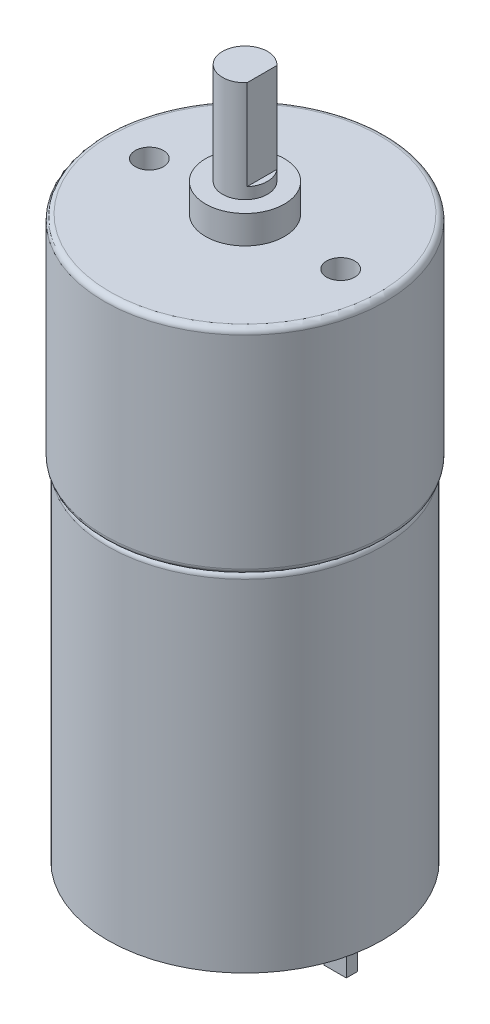
from build123d import *

# Parameters (mm, degrees)
SKETCH1_R                 = 12.2
BOSS_EXTRUDE1_DEPTH       = 30.8
FILLET1_R                 = 0.5
SKETCH2_R                 = 12.5
BOSS_EXTRUDE2_DEPTH       = 19
SKETCH3_R                 = 3.5
BOSS_EXTRUDE3_DEPTH       = 2.5
SKETCH4_R                 = 2
BOSS_EXTRUDE4_DEPTH       = 9
CUT_EXTRUDE1_START        = -8
CUT_EXTRUDE1_DEPTH        = 8
FILLET2_R                 = 0.5
M3X0_5_TAPPED_HOLE1_D     = 2.5
M3X0_5_TAPPED_HOLE1_DEPTH = 5
M3X0_5_TAPPED_HOLE1_TIP   = 0.751075774
SKETCH10_W                = 2
SKETCH10_H                = 1
BOSS_EXTRUDE5_DEPTH       = 4
SKETCH11_R                = 3.25
BOSS_EXTRUDE6_DEPTH       = 2


with BuildPart() as part:
    # Sketch1 → Boss-Extrude1 (new body)
    with BuildSketch(Plane(origin=(0, 0, 0), x_dir=(1, 0, 0), z_dir=(0, 1, 0))):
        Circle(SKETCH1_R)
    extrude(amount=BOSS_EXTRUDE1_DEPTH)

    # Fillet1
    fillet1_edges = [part.edges().sort_by_distance(p)[0] for p in [
        (-12.2, 30.8, 0),
    ]]
    fillet(fillet1_edges, radius=FILLET1_R)

    # Sketch2 → Boss-Extrude2 (add)
    with BuildSketch(Plane(origin=(0, 30.8, 0), x_dir=(1, 0, 0), z_dir=(0, 1, 0))):
        Circle(SKETCH2_R)
    extrude(amount=BOSS_EXTRUDE2_DEPTH)

    # Sketch3 → Boss-Extrude3 (add)
    with BuildSketch(Plane(origin=(0, 49.8, 0), x_dir=(1, 0, 0), z_dir=(0, 1, 0))):
        Circle(SKETCH3_R)
    extrude(amount=BOSS_EXTRUDE3_DEPTH)

    # Sketch4 → Boss-Extrude4 (add)
    with BuildSketch(Plane(origin=(0, 52.3, 0), x_dir=(1, 0, 0), z_dir=(0, 1, 0))):
        Circle(SKETCH4_R)
    extrude(amount=BOSS_EXTRUDE4_DEPTH)

    # Sketch5 → Cut-Extrude1 (cut)
    with BuildSketch(Plane(origin=(0, 61.3, 0), x_dir=(1, 0, 0), z_dir=(0, 1, 0)).offset(CUT_EXTRUDE1_START)):
        with BuildLine():
            Line((1.5, 1.322875656), (1.5, -1.322875656))
            ThreePointArc((1.5, -1.322875656), (2, 0), (1.5, 1.322875656))
        make_face()
    extrude(amount=CUT_EXTRUDE1_DEPTH, mode=Mode.SUBTRACT)

    # Fillet2
    fillet2_edges = [part.edges().sort_by_distance(p)[0] for p in [
        (-12.5, 49.8, 0),
        (-12.5, 30.8, 0),
    ]]
    fillet(fillet2_edges, radius=FILLET2_R)

    # M3x0.5 Tapped Hole1
    with Locations(Plane(origin=(0, 49.8, 0), x_dir=(1, 0, 0), z_dir=(0, 1, 0))):
        with Locations((-8.5, 0), (8.5, 0)):
            Hole(M3X0_5_TAPPED_HOLE1_D / 2, depth=M3X0_5_TAPPED_HOLE1_DEPTH)
            with Locations((0, 0, -(M3X0_5_TAPPED_HOLE1_DEPTH + M3X0_5_TAPPED_HOLE1_TIP / 2))):  # 118° drill point
                Cone(0, M3X0_5_TAPPED_HOLE1_D / 2, M3X0_5_TAPPED_HOLE1_TIP, mode=Mode.SUBTRACT)

    # Sketch10 → Boss-Extrude5 (add)
    with BuildSketch(Plane.XZ):
        with Locations((-8.5, 0)):
            Rectangle(SKETCH10_W, SKETCH10_H)
        with Locations((8.5, 0)):
            Rectangle(SKETCH10_W, SKETCH10_H)
    extrude(amount=BOSS_EXTRUDE5_DEPTH)

    # Sketch11 → Boss-Extrude6 (add)
    with BuildSketch(Plane.XZ):
        Circle(SKETCH11_R)
    extrude(amount=BOSS_EXTRUDE6_DEPTH)


solid = part.part
